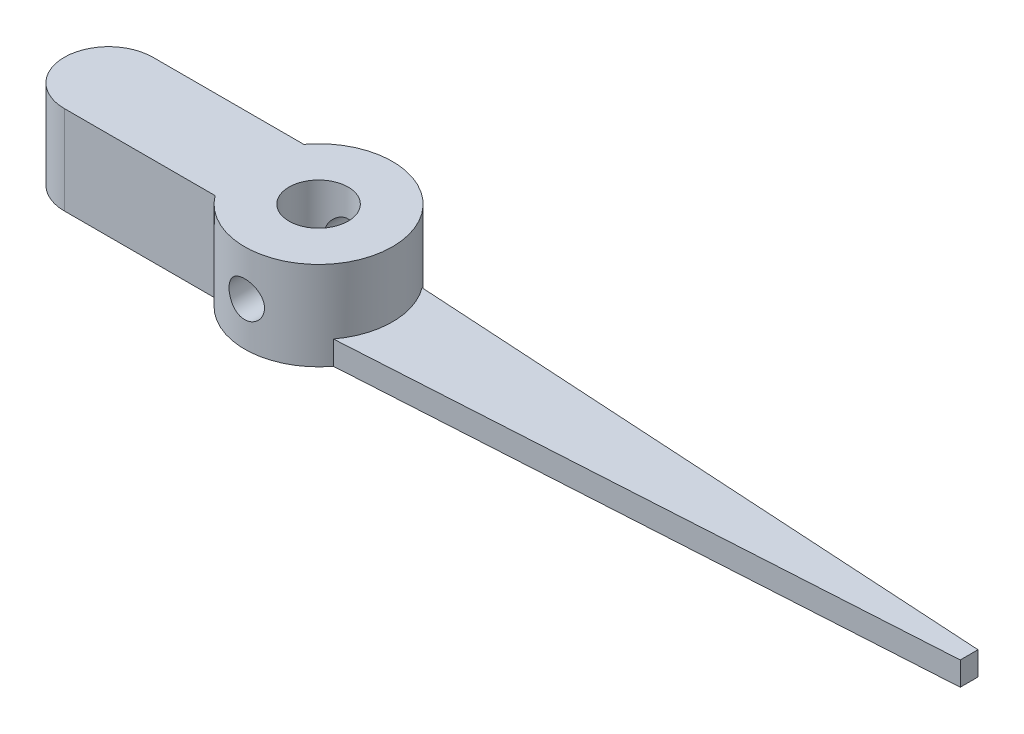
from build123d import *

# Parameters (mm, degrees)
HUB_SKETCH_R              = 2.5
HUB_DEPTH                 = 3
POINTER_DEPTH             = 0.8
TAIL_SKETCH_W             = 7.1
TAIL_SKETCH_H             = 3
TAIL_DEPTH                = 3
TAIL_END_SKETCH_R         = 1.5
TAIL_END_DEPTH            = 3
SHAFT_BORE_DEPTH          = 23.343902972
SHAFT_BORE_DEPTH_BACK     = 23.343902972
BORE_SKETCH_R             = 1
SET_SCREW_HOLE_DEPTH      = 23.343902972
SET_SCREW_HOLE_DEPTH_BACK = 23.343902972
SETSCREW_SKETCH_R         = 0.6


with BuildPart() as part:
    # HUB_SKETCH → HUB (new body)
    with BuildSketch(Plane(origin=(0, 0, 0), x_dir=(1, 0, 0), z_dir=(0, 1, 0))):
        Circle(HUB_SKETCH_R)
    extrude(amount=HUB_DEPTH)

    # POINTER_SKETCH → POINTER (add)
    with BuildSketch(Plane(origin=(0, 0, 0), x_dir=(1, 0, 0), z_dir=(0, 1, 0))):
        Polygon((2, 1.5), (22, 0.3), (22, -0.3), (2, -1.5), align=None)
    extrude(amount=POINTER_DEPTH)

    # TAIL_SKETCH → TAIL (add)
    with BuildSketch(Plane(origin=(0, 0, 0), x_dir=(1, 0, 0), z_dir=(0, 1, 0))):
        with Locations((-3.55, 0)):
            Rectangle(TAIL_SKETCH_W, TAIL_SKETCH_H)
    extrude(amount=TAIL_DEPTH)

    # TAIL_END_SKETCH → TAIL_END (add)
    with BuildSketch(Plane(origin=(0, 0, 0), x_dir=(1, 0, 0), z_dir=(0, 1, 0))):
        with Locations((-7.1, 0)):
            Circle(TAIL_END_SKETCH_R)
    extrude(amount=TAIL_END_DEPTH)

    # BORE_SKETCH → SHAFT_BORE (cut, two sides: drawn at the far end of the back side and taken through both)
    with BuildSketch(Plane(origin=(0, 0, 0), x_dir=(1, 0, 0), z_dir=(0, 1, 0)).offset(-SHAFT_BORE_DEPTH_BACK)):
        Circle(BORE_SKETCH_R)
    extrude(amount=SHAFT_BORE_DEPTH + SHAFT_BORE_DEPTH_BACK, mode=Mode.SUBTRACT)

    # SETSCREW_SKETCH → SET_SCREW_HOLE (cut, two sides: drawn at the far end of the back side and taken through both)
    with BuildSketch(Plane.XY.offset(-SET_SCREW_HOLE_DEPTH_BACK)):
        with Locations((0, 1.46538664)):
            Circle(SETSCREW_SKETCH_R)
    extrude(amount=SET_SCREW_HOLE_DEPTH + SET_SCREW_HOLE_DEPTH_BACK, mode=Mode.SUBTRACT)


solid = part.part
